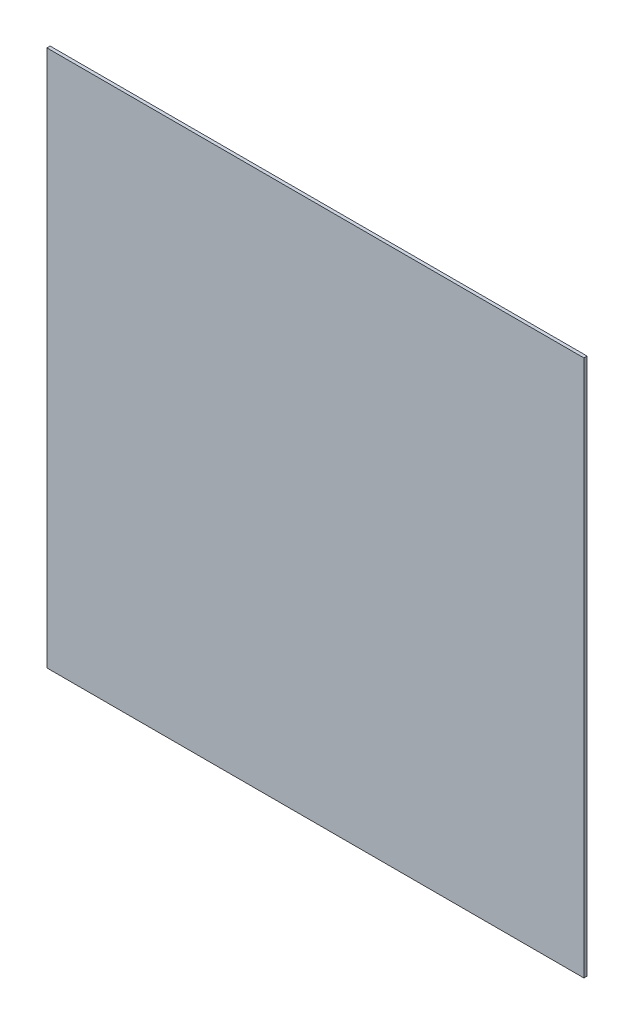
from build123d import *

# Parameters (mm, degrees)
SKETCH1_W           = 127
SKETCH1_H           = 127
BOSS_EXTRUDE1_DEPTH = 0.762


with BuildPart() as part:
    # Sketch1 → Boss-Extrude1 (new body)
    with BuildSketch(Plane.XY):
        with Locations((63.5, 63.5)):
            Rectangle(SKETCH1_W, SKETCH1_H)
    extrude(amount=BOSS_EXTRUDE1_DEPTH)


solid = part.part
